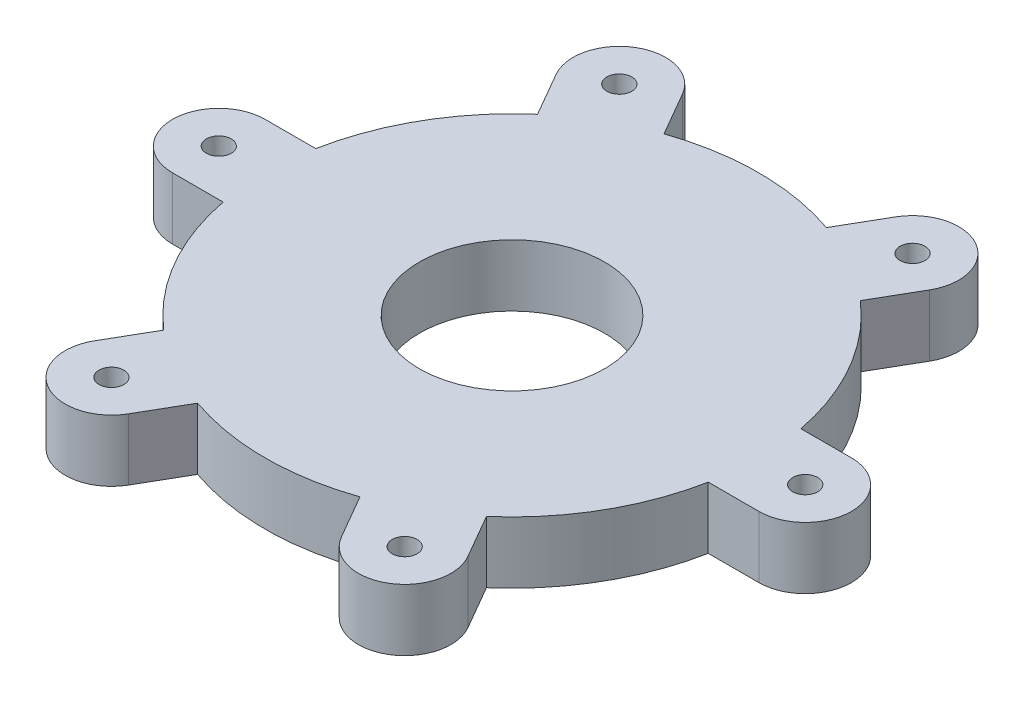
from build123d import *

# Parameters (mm, degrees)
SKETCH1_R                  = 25
SKETCH1_R_2                = 15
BOSS_EXTRUDE1_DEPTH        = 5
SKETCH6_R                  = 40
SKETCH6_R_2                = 25
BOSS_EXTRUDE3_DEPTH        = 10
SKETCH7_R                  = 7
CUT_EXTRUDE1_DEPTH         = 5
BOSS_EXTRUDE4_DEPTH        = 10
TAP_DRILL_FOR_10_32_TAP1_D = 4.0386
CIRPATTERN1_COUNT          = 6


with BuildPart() as part:
    # Sketch1 → Boss-Extrude1 (new, symmetric)
    with BuildSketch(Plane(origin=(0, 0, 0), x_dir=(1, 0, 0), z_dir=(0, 1, 0))):
        with Locations(Location((0, 0, 0), (0, 0, 270))):
            Circle(SKETCH1_R)
        with Locations(Location((0, 0, 0), (0, 0, 270))):
            Circle(SKETCH1_R_2, mode=Mode.SUBTRACT)
    extrude(amount=BOSS_EXTRUDE1_DEPTH, both=True)

    # Sketch6 → Boss-Extrude3 (add)
    with BuildSketch(Plane(origin=(0, 5, 0), x_dir=(1, 0, 0), z_dir=(0, 1, 0))):
        with Locations(Location((0, 0, 0), (0, 0, 270))):
            Circle(SKETCH6_R)
        Circle(SKETCH6_R_2, mode=Mode.SUBTRACT)
    extrude(amount=-BOSS_EXTRUDE3_DEPTH)

    # Sketch7 → Cut-Extrude1 (cut)
    with BuildSketch(Plane.XZ.offset(5)):
        with Locations(Location((21.817216858, 16.740939298, 0), (0, 0, 270))):
            Circle(SKETCH7_R)
        with Locations(Location((-2.585088545, 27.378227065, 0), (0, 0, 270))):
            Circle(SKETCH7_R)
        with Locations(Location((-24.565103939, 12.361458995, 0), (0, 0, 270))):
            Circle(SKETCH7_R)
        with Locations(Location((-23.52702738, -14.238292828, 0), (0, 0, 270))):
            Circle(SKETCH7_R)
        with Locations(Location((0, -27.5, 0), (0, 0, 270))):
            Circle(SKETCH7_R)
        with Locations(Location((23.055532132, -14.989744431, 0), (0, 0, 270))):
            Circle(SKETCH7_R)
    extrude(amount=-CUT_EXTRUDE1_DEPTH, mode=Mode.SUBTRACT)

    # Sketch8 → Boss-Extrude4 (add)
    with BuildSketch(Plane(origin=(0, 5, 0), x_dir=(1, 0, 0), z_dir=(0, 1, 0))):
        with BuildLine():
            Line((47.5, 7.5), (39.290584114, 7.5))
            Line((39.290584114, 7.5), (39.290584114, -7.5))
            Line((39.290584114, -7.5), (47.5, -7.5))
            ThreePointArc((47.5, -7.5), (55, 0), (47.5, 7.5))
        make_face()
    boss_extrude4 = extrude(amount=-BOSS_EXTRUDE4_DEPTH)

    # Tap Drill for #10-32 Tap1 (through all)
    with Locations(Plane(origin=(0, 5, 0), x_dir=(1, 0, 0), z_dir=(0, 1, 0))):
        with Locations((47.5, 0)):
            tap_drill_for_10_32_tap1 = Hole(TAP_DRILL_FOR_10_32_TAP1_D / 2)

    # CirPattern1: Boss-Extrude4, Tap Drill for #10-32 Tap1 ×6 about axis
    cirpattern1_axis = Axis((0, 0, 0), (0, 1, 0))
    add([boss_extrude4.rotate(cirpattern1_axis, i * 360 / CIRPATTERN1_COUNT) for i in range(1, CIRPATTERN1_COUNT)])
    add([tap_drill_for_10_32_tap1.rotate(cirpattern1_axis, i * 360 / CIRPATTERN1_COUNT) for i in range(1, CIRPATTERN1_COUNT)], mode=Mode.SUBTRACT)


solid = part.part
